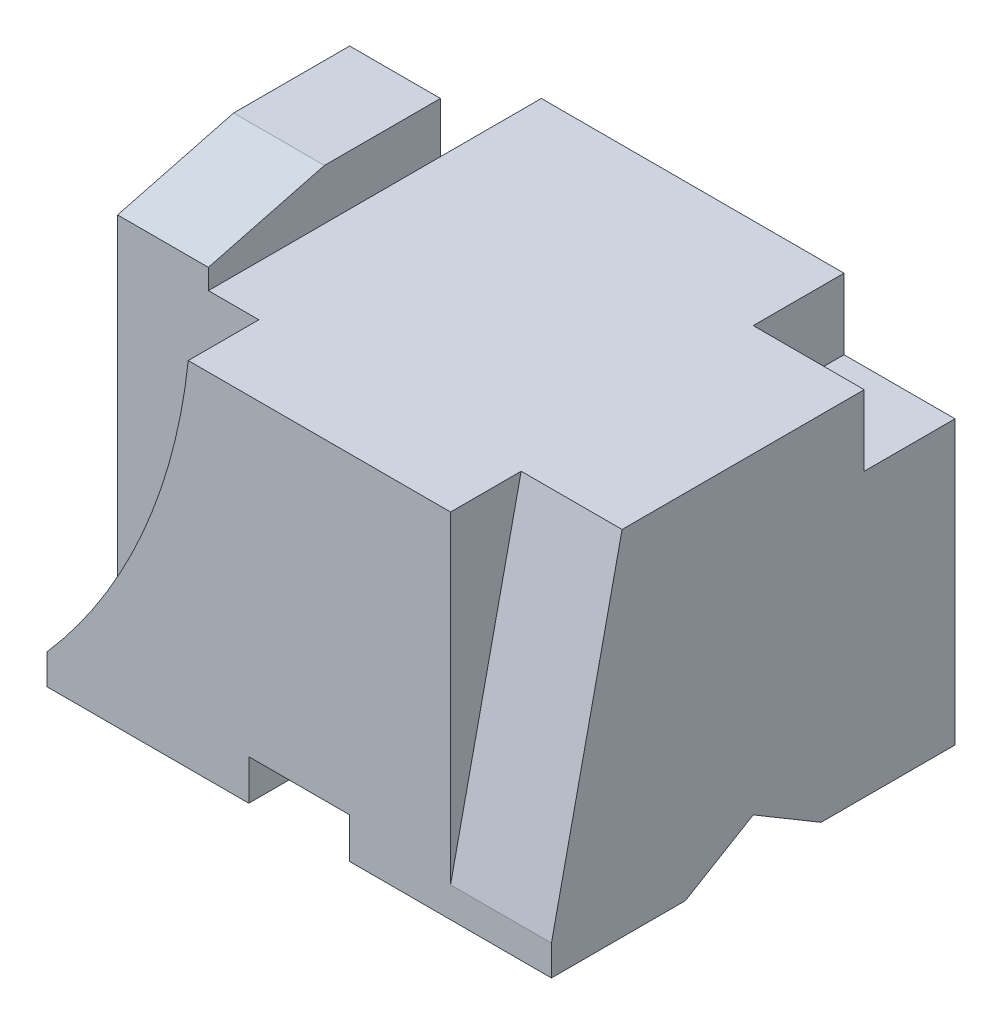
from build123d import *

# Parameters (mm, degrees)
SKETCH_1_W               = 50
SKETCH_1_H               = 40
EXTRUDE_1_DEPTH          = 40
CUT_EXTRUDE_1_DEPTH      = 76.498344353
CUT_EXTRUDE_1_DEPTH_BACK = 76.498344353
SKETCH_4_W               = 5
SKETCH_4_H               = 4
CUT_EXTRUDE_3_DEPTH      = 76.498344353
CUT_EXTRUDE_3_DEPTH_BACK = 76.498344353
CUT_EXTRUDE_4_DEPTH      = 76.498344353
CUT_EXTRUDE_4_DEPTH_BACK = 76.498344353
SKETCH_6_W               = 41
SKETCH_6_H               = 5
CUT_EXTRUDE_5_DEPTH      = 76.498344353
CUT_EXTRUDE_5_DEPTH_BACK = 7
CUT_EXTRUDE_6_DEPTH      = 76.498344353
CUT_EXTRUDE_6_DEPTH_BACK = 10
CUT_EXTRUDE_7_DEPTH      = 76.498344353
CUT_EXTRUDE_7_DEPTH_BACK = 9
CUT_EXTRUDE_8_DEPTH      = 76.498344353
CUT_EXTRUDE_8_DEPTH_BACK = 9
CUT_EXTRUDE_9_DEPTH      = 76.498344353
CUT_EXTRUDE_9_DEPTH_BACK = 9
SKETCH_15_W              = 11
SKETCH_15_H              = 7


with BuildPart() as part:
    # Эскиз1 → Бобышка-Вытянуть1 (new body)
    with BuildSketch(Plane(origin=(0, 0, 0), x_dir=(1, 0, 0), z_dir=(0, 1, 0))):
        with Locations((25, 20)):
            Rectangle(SKETCH_1_W, SKETCH_1_H)
    extrude(amount=EXTRUDE_1_DEPTH)

    # Эскиз4 → Вырез-Вытянуть1 (cut, two sides: drawn at the far end of the back side and taken through both)
    with BuildSketch(Plane.XY.offset(-CUT_EXTRUDE_1_DEPTH_BACK)):
        with Locations((22.5, 2)):
            Rectangle(SKETCH_4_W, SKETCH_4_H)
        with Locations((27.5, 2)):
            Rectangle(SKETCH_4_W, SKETCH_4_H)
    extrude(amount=CUT_EXTRUDE_1_DEPTH + CUT_EXTRUDE_1_DEPTH_BACK, mode=Mode.SUBTRACT)

    # Эскиз5 → Вырез-Вытянуть3 (cut, two sides: drawn at the far end of the back side and taken through both)
    with BuildSketch(Plane.ZY.offset(-CUT_EXTRUDE_3_DEPTH_BACK)):
        Polygon((-20, 4), (-26.721648091, 0), (-13.278351909, 0), align=None)
    extrude(amount=CUT_EXTRUDE_3_DEPTH + CUT_EXTRUDE_3_DEPTH_BACK, mode=Mode.SUBTRACT)

    # Эскиз6 → Вырез-Вытянуть4 (cut, two sides: drawn at the far end of the back side and taken through both)
    with BuildSketch(Plane.XY.offset(-CUT_EXTRUDE_4_DEPTH_BACK)):
        with Locations((29.5, 37.5)):
            Rectangle(SKETCH_6_W, SKETCH_6_H)
    extrude(amount=CUT_EXTRUDE_4_DEPTH + CUT_EXTRUDE_4_DEPTH_BACK, mode=Mode.SUBTRACT)

    # Эскиз8 → Вырез-Вытянуть5 (cut, two sides: drawn at the far end of the back side and taken through both)
    with BuildSketch(Plane.XY.offset(-CUT_EXTRUDE_5_DEPTH_BACK)):
        with BuildLine():
            ThreePointArc((0, 3), (9.466087362, 17.921086779), (14, 35))
            Line((14, 35), (9, 35))
            Line((9, 35), (9, 40))
            Line((9, 40), (0, 40))
            Line((0, 40), (0, 3))
        make_face()
    extrude(amount=CUT_EXTRUDE_5_DEPTH + CUT_EXTRUDE_5_DEPTH_BACK, mode=Mode.SUBTRACT)

    # Эскиз9 → Вырез-Вытянуть6 (cut, two sides: drawn at the far end of the back side and taken through both)
    with BuildSketch(Plane(origin=(50, 0, 0), x_dir=(0, 0, -1), z_dir=(1, 0, 0)).offset(-CUT_EXTRUDE_6_DEPTH_BACK)):
        Polygon((0, 35), (0, 3), (7, 35), align=None)
    extrude(amount=CUT_EXTRUDE_6_DEPTH + CUT_EXTRUDE_6_DEPTH_BACK, mode=Mode.SUBTRACT)

    # Эскиз11 → Вырез-Вытянуть7 (cut, two sides: drawn at the far end of the back side and taken through both)
    with BuildSketch(Plane.ZY.offset(-CUT_EXTRUDE_7_DEPTH_BACK)):
        Polygon((-150, 22), (-40, 22), (-30, 22), (-30, 40), (-30, 150), (-190.498184911, 300.467048354), (-310.498184911, 172.467048354), align=None)
    extrude(amount=CUT_EXTRUDE_7_DEPTH + CUT_EXTRUDE_7_DEPTH_BACK, mode=Mode.SUBTRACT)

    # Эскиз14 → Вырез-Вытянуть8 (cut, two sides: drawn at the far end of the back side and taken through both)
    with BuildSketch(Plane.ZY.offset(-CUT_EXTRUDE_8_DEPTH_BACK)):
        Polygon((-7, 40), (-18.5, 40), (-7, 37), align=None)
    extrude(amount=CUT_EXTRUDE_8_DEPTH + CUT_EXTRUDE_8_DEPTH_BACK, mode=Mode.SUBTRACT)

    # Эскиз15 → Вырез-Вытянуть9 (cut, two sides: drawn at the far end of the back side and taken through both)
    with BuildSketch(Plane(origin=(0, 0, -40), x_dir=(-1, 0, 0), z_dir=(0, 0, -1)).offset(-CUT_EXTRUDE_9_DEPTH_BACK)):
        with Locations((-44.5, 31.5)):
            Rectangle(SKETCH_15_W, SKETCH_15_H)
    extrude(amount=CUT_EXTRUDE_9_DEPTH + CUT_EXTRUDE_9_DEPTH_BACK, mode=Mode.SUBTRACT)


solid = part.part
